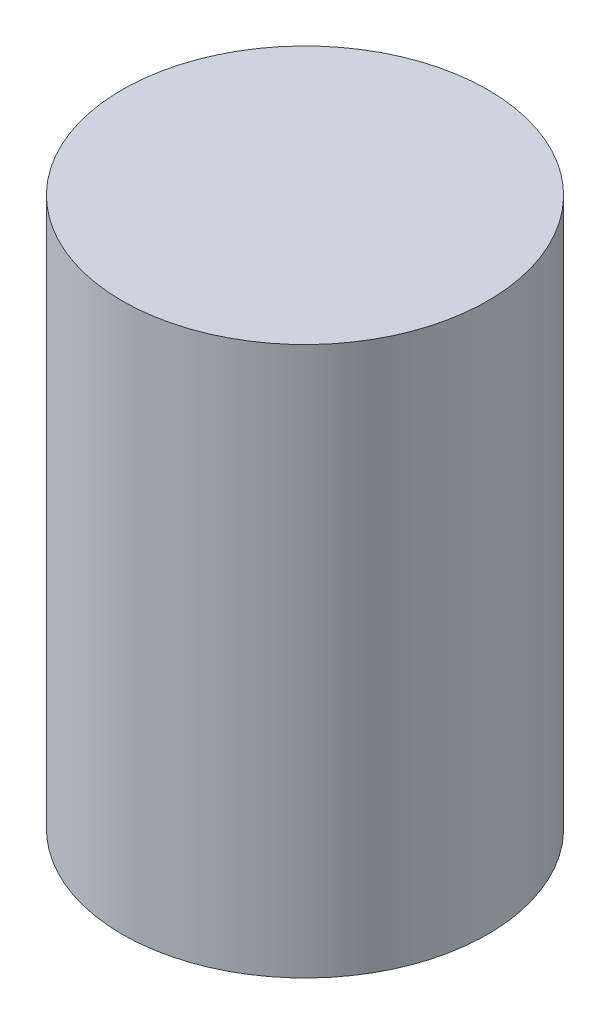
from build123d import *

# Parameters (mm, degrees)
SKETCH1_R   = 1.27
DOWEL_DEPTH = 3.81


with BuildPart() as part:
    # Sketch1 → Dowel (new body)
    with BuildSketch(Plane(origin=(0, 0, 0), x_dir=(1, 0, 0), z_dir=(0, 1, 0))):
        with Locations(Location((0, 0, 0), (0, 0, 90))):
            Circle(SKETCH1_R)
    extrude(amount=DOWEL_DEPTH)


solid = part.part
